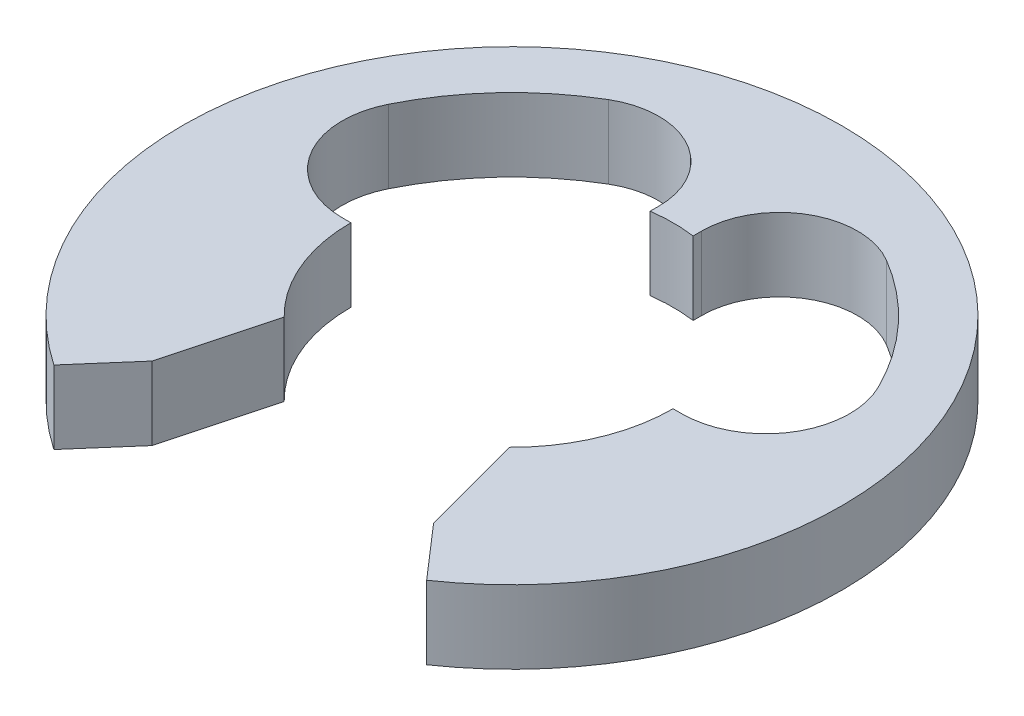
from build123d import *

# Parameters (mm, degrees)
BASE_EXTRUDE_DEPTH = 0.5


with BuildPart() as part:
    # Sketch1 → Base-Extrude (new body)
    with BuildSketch(Plane(origin=(0, 0, 0), x_dir=(1, 0, 0), z_dir=(0, 1, 0))):
        with BuildLine():
            Line((0.77, -0.785557127), (0.960376464, -1.496051762))
            Line((0.960376464, -1.496051762), (1.272766377, -1.85541525))
            ThreePointArc((1.272766377, -1.85541525), (0, 2.25), (-1.272766377, -1.85541525))
            Line((-1.272766377, -1.85541525), (-0.960376464, -1.496051762))
            Line((-0.960376464, -1.496051762), (-0.77, -0.785557127))
            ThreePointArc((-0.77, -0.785557127), (-1.01414989, -0.426028168), (-1.1, 0))
            Line((-1.1, 0), (-1.158666667, 0))
            ThreePointArc((-1.158666667, 0), (-1.646127767, 0.271158788), (-1.672819156, 0.828323919))
            ThreePointArc((-1.672819156, 0.828323919), (-1.367825606, 1.270235236), (-0.949656695, 1.607045925))
            ThreePointArc((-0.949656695, 1.607045925), (-0.41511596, 1.61110607), (-0.146666667, 1.148845041))
            Line((-0.146666667, 1.148845041), (-0.146666667, 1.090178375))
            ThreePointArc((-0.146666667, 1.090178375), (0, 1.1), (0.146666667, 1.090178375))
            Line((0.146666667, 1.090178375), (0.146666667, 1.148845041))
            ThreePointArc((0.146666667, 1.148845041), (0.41511596, 1.61110607), (0.949656695, 1.607045925))
            ThreePointArc((0.949656695, 1.607045925), (1.367825606, 1.270235236), (1.672819156, 0.828323919))
            ThreePointArc((1.672819156, 0.828323919), (1.646127767, 0.271158788), (1.158666667, 0))
            Line((1.158666667, 0), (1.1, 0))
            ThreePointArc((1.1, 0), (1.01414989, -0.426028168), (0.77, -0.785557127))
        make_face()
    extrude(amount=-BASE_EXTRUDE_DEPTH)


solid = part.part
